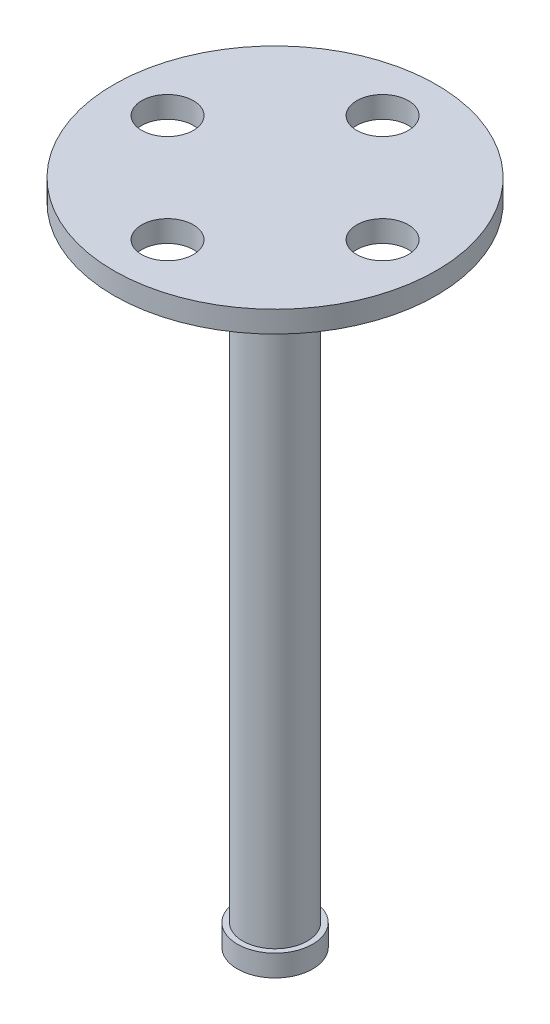
from build123d import *

# Parameters (mm, degrees)
SKETCH_1_R      = 17.5
EXTRUDE_1_DEPTH = 10
SKETCH_2_R      = 15
EXTRUDE_2_DEPTH = 300
SKETCH_3_R      = 75
EXTRUDE_3_DEPTH = 10
FILLET_1_R      = 10
HOLE_WIZARD_1_D = 24


with BuildPart() as part:
    # 草图1 → 凸台-拉伸1 (new body)
    with BuildSketch(Plane(origin=(0, 0, 0), x_dir=(1, 0, 0), z_dir=(0, 1, 0))):
        with Locations(Location((0, 0, 0), (0, 0, 270))):
            Circle(SKETCH_1_R)
    extrude(amount=EXTRUDE_1_DEPTH)

    # 草图2 → 凸台-拉伸2 (add)
    with BuildSketch(Plane(origin=(0, 0, 0), x_dir=(1, 0, 0), z_dir=(0, 1, 0))):
        with Locations(Location((0, 0, 0), (0, 0, 270))):
            Circle(SKETCH_2_R)
    extrude(amount=EXTRUDE_2_DEPTH)

    # 草图3 → 凸台-拉伸3 (add)
    with BuildSketch(Plane(origin=(0, 300, 0), x_dir=(1, 0, 0), z_dir=(0, 1, 0))):
        with Locations(Location((0, 0, 0), (0, 0, 270))):
            Circle(SKETCH_3_R)
    extrude(amount=EXTRUDE_3_DEPTH)

    # 圆角1
    fillet_1_edges = [part.edges().sort_by_distance(p)[0] for p in [
        (0, 300, -15),
    ]]
    fillet(fillet_1_edges, radius=FILLET_1_R)

    # 孔1 (through all)
    with Locations(Plane(origin=(0, 310, 0), x_dir=(1, 0, 0), z_dir=(0, 1, 0))):
        with Locations((0, 50), (50, 0), (0, -50), (-50, 0)):
            Hole(HOLE_WIZARD_1_D / 2)


solid = part.part
